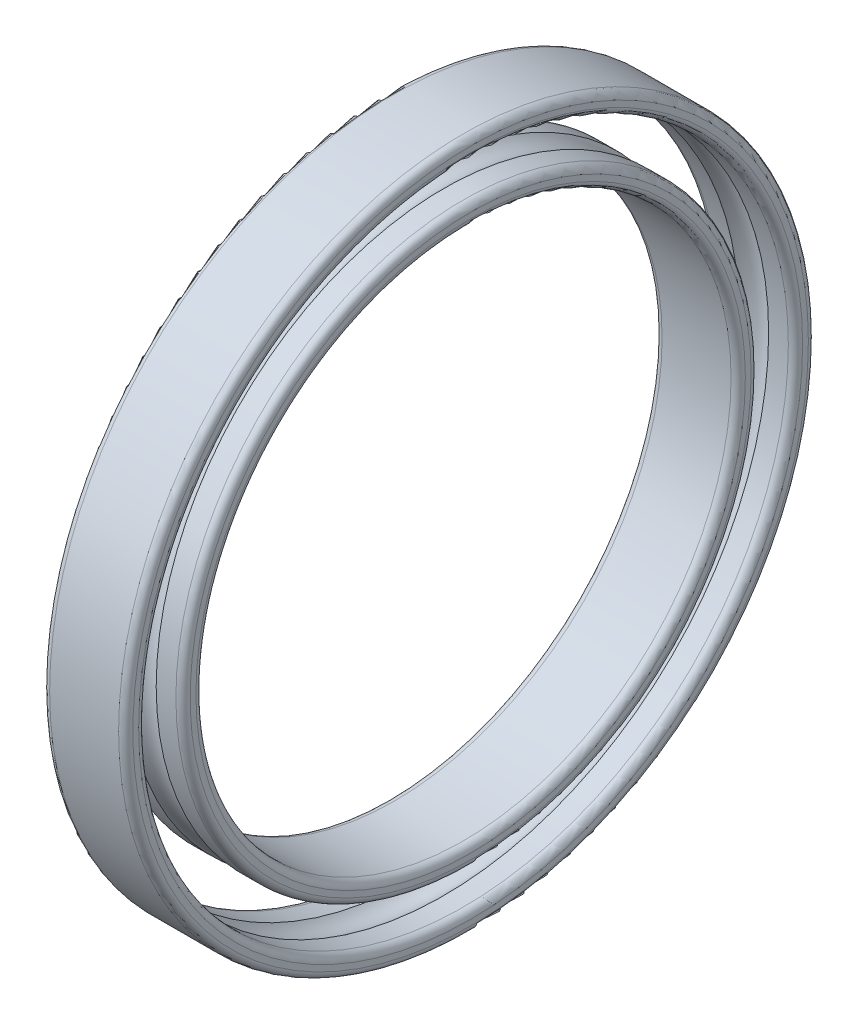
from build123d import *

# Parameters (mm, degrees)
FILLET1_R = 0.6
FILLET2_R = 0.6
FILLET3_R = 0.6


with BuildPart() as part:
    # Sketch1 → Revolve1 (revolve)
    with BuildSketch(Plane.XY, mode=Mode.PRIVATE) as revolve1_sk:
        with BuildLine():
            Line((-3.5, 29), (3.5, 29))
            Line((3.5, 29), (3.5, 27.315744302))
            Line((3.5, 27.315744302), (1.244365212, 27.315744302))
            ThreePointArc((1.244365212, 27.315744302), (0, 27.75), (-1.244365212, 27.315744302))
            Line((-1.244365212, 27.315744302), (-3.5, 27.315744302))
            Line((-3.5, 27.315744302), (-3.5, 29))
        make_face()
        with BuildLine():
            Line((-3.5, 22.5), (3.5, 22.5))
            Line((3.5, 22.5), (3.5, 24.184255698))
            Line((3.5, 24.184255698), (1.244365212, 24.184255698))
            ThreePointArc((1.244365212, 24.184255698), (0, 23.75), (-1.244365212, 24.184255698))
            Line((-1.244365212, 24.184255698), (-3.5, 24.184255698))
            Line((-3.5, 24.184255698), (-3.5, 22.5))
        make_face()
    revolve(revolve1_sk.sketch.rotate(Axis((0, 0, 0), (-1, 0, 0)), 90), axis=Axis((0, 0, 0), (-1, 0, 0)))

    # Fillet1
    fillet1_edges = [part.edges().sort_by_distance(p)[0] for p in [
        (3.5, 0, 29),
        (3.5, 0, 27.315744302),
        (-3.5, 0, 27.315744302),
    ]]
    fillet(fillet1_edges, radius=FILLET1_R)

    # Fillet2
    fillet2_edges = [part.edges().sort_by_distance(p)[0] for p in [
        (-3.5, 0, 29),
    ]]
    fillet(fillet2_edges, radius=FILLET2_R)

    # Fillet3
    fillet3_edges = [part.edges().sort_by_distance(p)[0] for p in [
        (3.5, 0, 22.5),
        (-3.5, 0, 22.5),
        (-3.5, 0, 24.184255698),
        (3.5, 0, 24.184255698),
    ]]
    fillet(fillet3_edges, radius=FILLET3_R)


solid = part.part
